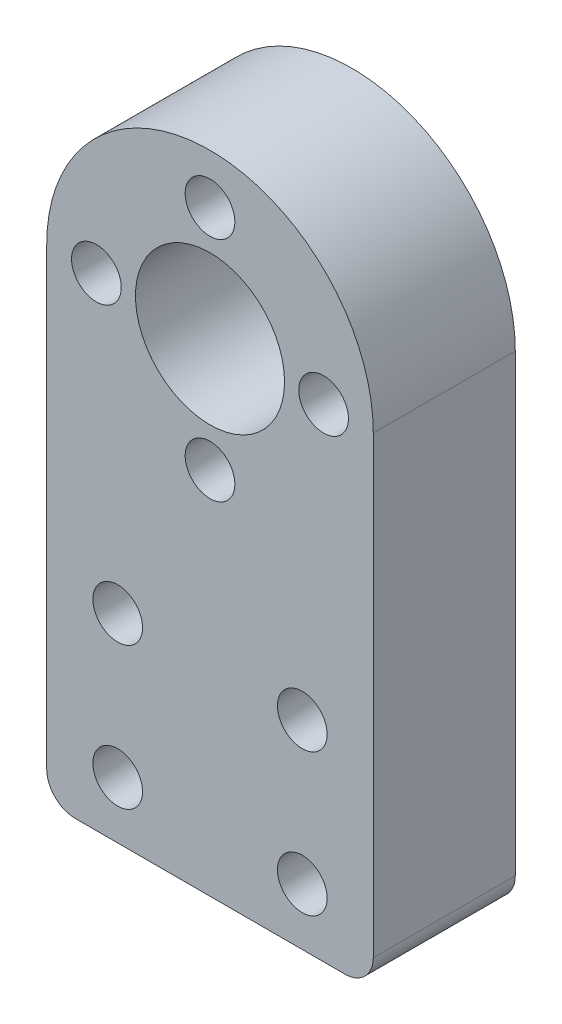
from build123d import *

# Parameters (mm, degrees)
BOSS_EXTRUDE1_DEPTH = 10
CUT_EXTRUDE1_REACH  = 34.319
SKETCH4_R           = 5.25
CUT_EXTRUDE2_REACH  = 34.319
SKETCH6_R           = 1.75
CUT_EXTRUDE3_REACH  = 34.319
SKETCH7_R           = 1.75
FILLET1_R           = 2


with BuildPart() as part:
    # Sketch2 → Boss-Extrude1 (new body)
    with BuildSketch(Plane.XY):
        with BuildLine():
            Line((11.5, -17), (-11.5, -17))
            Line((-11.5, -17), (-11.5, 17))
            ThreePointArc((-11.5, 17), (0, 28.5), (11.5, 17))
            Line((11.5, 17), (11.5, -17))
        make_face()
    extrude(amount=BOSS_EXTRUDE1_DEPTH)

    # Sketch4 → Cut-Extrude1 (cut, up to next)
    with BuildSketch(Plane.XY.offset(10), mode=Mode.PRIVATE) as cut_extrude1_sk1:
        with Locations((0, 17)):
            Circle(SKETCH4_R)
    cut_extrude1_tool1 = extrude(cut_extrude1_sk1.sketch, amount=-CUT_EXTRUDE1_REACH, mode=Mode.PRIVATE) & part.part
    add(cut_extrude1_tool1.solids().sort_by_distance((0, 17, 10))[0], mode=Mode.SUBTRACT)

    # Sketch6 → Cut-Extrude2 (cut, up to next)
    with BuildSketch(Plane(origin=(0, 0, 0), x_dir=(-1, 0, 0), z_dir=(0, 0, -1)), mode=Mode.PRIVATE) as cut_extrude2_sk1:
        with Locations((0, 25)):
            Circle(SKETCH6_R)
    cut_extrude2_tool1 = extrude(cut_extrude2_sk1.sketch, amount=-CUT_EXTRUDE2_REACH, mode=Mode.PRIVATE) & part.part
    # Sketch6 → Cut-Extrude2 (cut, up to next)
    with BuildSketch(Plane(origin=(0, 0, 0), x_dir=(-1, 0, 0), z_dir=(0, 0, -1)), mode=Mode.PRIVATE) as cut_extrude2_sk2:
        with Locations((8, 17)):
            Circle(SKETCH6_R)
    cut_extrude2_tool2 = extrude(cut_extrude2_sk2.sketch, amount=-CUT_EXTRUDE2_REACH, mode=Mode.PRIVATE) & part.part
    # Sketch6 → Cut-Extrude2 (cut, up to next)
    with BuildSketch(Plane(origin=(0, 0, 0), x_dir=(-1, 0, 0), z_dir=(0, 0, -1)), mode=Mode.PRIVATE) as cut_extrude2_sk3:
        with Locations((0, 9)):
            Circle(SKETCH6_R)
    cut_extrude2_tool3 = extrude(cut_extrude2_sk3.sketch, amount=-CUT_EXTRUDE2_REACH, mode=Mode.PRIVATE) & part.part
    # Sketch6 → Cut-Extrude2 (cut, up to next)
    with BuildSketch(Plane(origin=(0, 0, 0), x_dir=(-1, 0, 0), z_dir=(0, 0, -1)), mode=Mode.PRIVATE) as cut_extrude2_sk4:
        with Locations((-8, 17)):
            Circle(SKETCH6_R)
    cut_extrude2_tool4 = extrude(cut_extrude2_sk4.sketch, amount=-CUT_EXTRUDE2_REACH, mode=Mode.PRIVATE) & part.part
    add(cut_extrude2_tool1.solids().sort_by_distance((0, 25, 0))[0], mode=Mode.SUBTRACT)
    add(cut_extrude2_tool2.solids().sort_by_distance((-8, 17, 0))[0], mode=Mode.SUBTRACT)
    add(cut_extrude2_tool3.solids().sort_by_distance((0, 9, 0))[0], mode=Mode.SUBTRACT)
    add(cut_extrude2_tool4.solids().sort_by_distance((8, 17, 0))[0], mode=Mode.SUBTRACT)

    # Sketch7 → Cut-Extrude3 (cut, up to next)
    with BuildSketch(Plane(origin=(0, 0, 0), x_dir=(-1, 0, 0), z_dir=(0, 0, -1)), mode=Mode.PRIVATE) as cut_extrude3_sk1:
        with Locations((-6.5, -3)):
            Circle(SKETCH7_R)
    cut_extrude3_tool1 = extrude(cut_extrude3_sk1.sketch, amount=-CUT_EXTRUDE3_REACH, mode=Mode.PRIVATE) & part.part
    # Sketch7 → Cut-Extrude3 (cut, up to next)
    with BuildSketch(Plane(origin=(0, 0, 0), x_dir=(-1, 0, 0), z_dir=(0, 0, -1)), mode=Mode.PRIVATE) as cut_extrude3_sk2:
        with Locations((6.5, -3)):
            Circle(SKETCH7_R)
    cut_extrude3_tool2 = extrude(cut_extrude3_sk2.sketch, amount=-CUT_EXTRUDE3_REACH, mode=Mode.PRIVATE) & part.part
    # Sketch7 → Cut-Extrude3 (cut, up to next)
    with BuildSketch(Plane(origin=(0, 0, 0), x_dir=(-1, 0, 0), z_dir=(0, 0, -1)), mode=Mode.PRIVATE) as cut_extrude3_sk3:
        with Locations((6.5, -13)):
            Circle(SKETCH7_R)
    cut_extrude3_tool3 = extrude(cut_extrude3_sk3.sketch, amount=-CUT_EXTRUDE3_REACH, mode=Mode.PRIVATE) & part.part
    # Sketch7 → Cut-Extrude3 (cut, up to next)
    with BuildSketch(Plane(origin=(0, 0, 0), x_dir=(-1, 0, 0), z_dir=(0, 0, -1)), mode=Mode.PRIVATE) as cut_extrude3_sk4:
        with Locations((-6.5, -13)):
            Circle(SKETCH7_R)
    cut_extrude3_tool4 = extrude(cut_extrude3_sk4.sketch, amount=-CUT_EXTRUDE3_REACH, mode=Mode.PRIVATE) & part.part
    add(cut_extrude3_tool1.solids().sort_by_distance((6.5, -3, 0))[0], mode=Mode.SUBTRACT)
    add(cut_extrude3_tool2.solids().sort_by_distance((-6.5, -3, 0))[0], mode=Mode.SUBTRACT)
    add(cut_extrude3_tool3.solids().sort_by_distance((-6.5, -13, 0))[0], mode=Mode.SUBTRACT)
    add(cut_extrude3_tool4.solids().sort_by_distance((6.5, -13, 0))[0], mode=Mode.SUBTRACT)

    # Fillet1
    fillet1_edges = [part.edges().sort_by_distance(p)[0] for p in [
        (11.5, -17, 5),
        (-11.5, -17, 5),
    ]]
    fillet(fillet1_edges, radius=FILLET1_R)


solid = part.part
